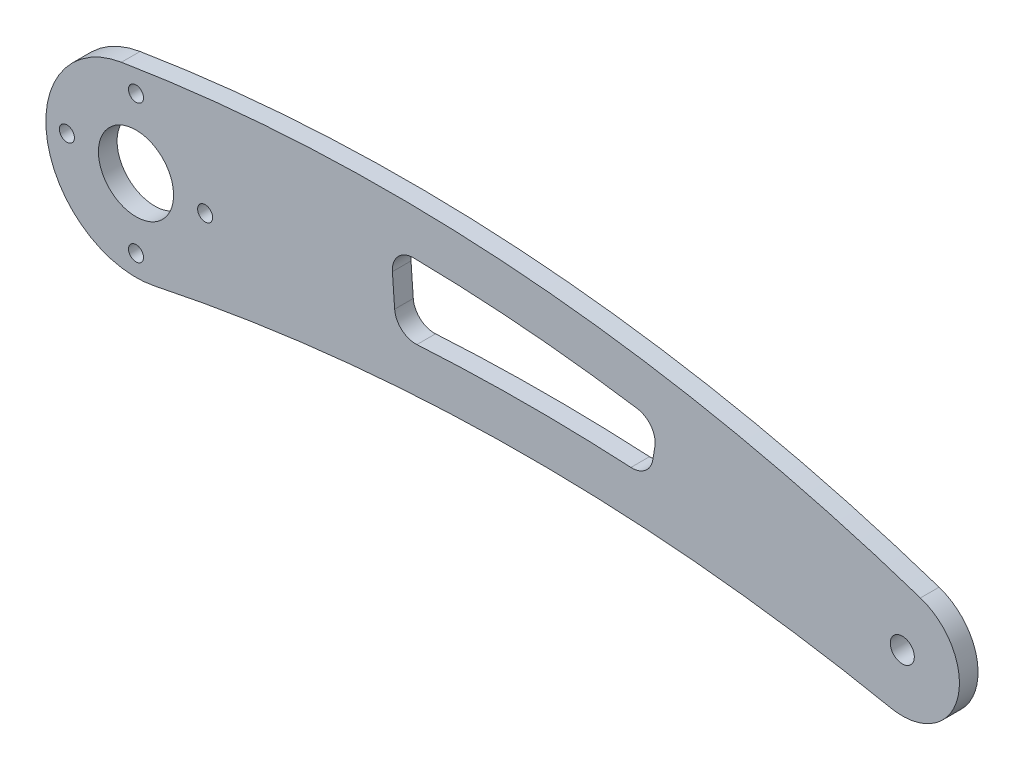
from build123d import *

# Parameters (mm, degrees)
SKETCH1_R           = 4
SKETCH1_R_2         = 2.5
SKETCH1_R_3         = 12.5
BOSS_EXTRUDE1_DEPTH = 6.2


with BuildPart() as part:
    # Sketch1 → Boss-Extrude1 (new body)
    with BuildSketch(Plane.XY):
        with BuildLine():
            ThreePointArc((-4.843381354, 29.606446208), (-29.489039073, -5.513308858), (6.180402599, -29.356474988))
            ThreePointArc((6.180402599, -29.356474988), (128.63005147, -16.382678773), (251.170355628, -28.47026553))
            ThreePointArc((251.170355628, -28.47026553), (273.303133895, -14.765534175), (260.982883768, 8.166778664))
            ThreePointArc((260.982883768, 8.166778664), (129.376669821, 35.090841966), (-4.843381354, 29.606446208))
        make_face()
        with Locations(Location((254.95, -9.85, 0), (0, 0, 180))):
            Circle(SKETCH1_R, mode=Mode.SUBTRACT)
        with Locations(Location((0, 23, 0), (0, 0, 180))):
            Circle(SKETCH1_R_2, mode=Mode.SUBTRACT)
        with Locations(Location((0, -23, 0), (0, 0, 180))):
            Circle(SKETCH1_R_2, mode=Mode.SUBTRACT)
        with Locations(Location((-23, 0, 0), (0, 0, 180))):
            Circle(SKETCH1_R_2, mode=Mode.SUBTRACT)
        with Locations(Location((23, 0, 0), (0, 0, 180))):
            Circle(SKETCH1_R_2, mode=Mode.SUBTRACT)
        with Locations(Location((0, 0, 0), (0, 0, 180))):
            Circle(SKETCH1_R_3, mode=Mode.SUBTRACT)
        with BuildLine():
            Line((85.299988347, 14.334161591), (86.047515876, 3.894174942))
            ThreePointArc((86.047515876, 3.894174942), (88.416575223, -0.870831987), (93.451584576, -2.593160073))
            ThreePointArc((93.451584576, -2.593160073), (129.051714651, -1.468455886), (164.657677356, -2.390215498))
            ThreePointArc((164.657677356, -2.390215498), (169.415573807, -0.864394835), (171.943987902, 3.445225739))
            Line((171.943987902, 3.445225739), (172.629734019, 7.547504331))
            ThreePointArc((172.629734019, 7.547504331), (171.396804828, 12.804877005), (166.788880257, 15.62038992))
            ThreePointArc((166.788880257, 15.62038992), (129.692411097, 20.014503602), (92.380913243, 21.833400801))
            ThreePointArc((92.380913243, 21.833400801), (87.192448356, 19.639856576), (85.299988347, 14.334161591))
        make_face(mode=Mode.SUBTRACT)
    extrude(amount=BOSS_EXTRUDE1_DEPTH)


solid = part.part
